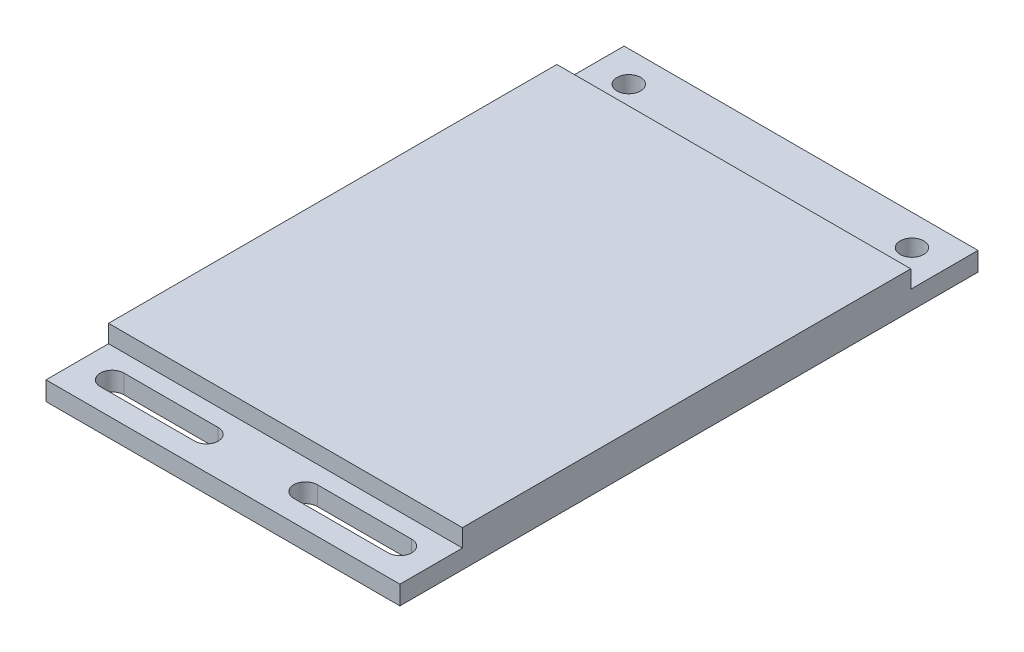
from build123d import *

# Parameters (mm, degrees)
SKETCH_1_W      = 30
SKETCH_1_H      = 49
SKETCH_1_R      = 1
EXTRUDE_1_DEPTH = 1.6
SKETCH_2_W      = 30
SKETCH_2_H      = 38
EXTRUDE_2_DEPTH = 1.5
SKETCH_3_W      = 8.4
SKETCH_3_H      = 5
EXTRUDE_3_DEPTH = 2


with BuildPart() as part:
    # 草图1 → 凸台-拉伸1 (new body)
    with BuildSketch(Plane(origin=(0, 0, 0), x_dir=(1, 0, 0), z_dir=(0, 1, 0))):
        with Locations((15, -24.5)):
            Rectangle(SKETCH_1_W, SKETCH_1_H)
        with BuildLine():
            ThreePointArc((2.8, -47.2), (1.8, -46.2), (2.8, -45.2))
            Line((2.8, -45.2), (10.8, -45.2))
            ThreePointArc((10.8, -45.2), (11.507106781, -45.492893219), (11.8, -46.2))
            ThreePointArc((11.8, -46.2), (11.507106781, -46.907106781), (10.8, -47.2))
            Line((10.8, -47.2), (2.8, -47.2))
        make_face(mode=Mode.SUBTRACT)
        with BuildLine():
            ThreePointArc((19.2, -47.2), (18.2, -46.2), (19.2, -45.2))
            Line((19.2, -45.2), (27.2, -45.2))
            ThreePointArc((27.2, -45.2), (27.907106781, -45.492893219), (28.2, -46.2))
            ThreePointArc((28.2, -46.2), (27.907106781, -46.907106781), (27.2, -47.2))
            Line((27.2, -47.2), (19.2, -47.2))
        make_face(mode=Mode.SUBTRACT)
        with Locations(Location((3, -2.6, 0), (0, 0, 270))):
            Circle(SKETCH_1_R, mode=Mode.SUBTRACT)
        with Locations(Location((27, -2.6, 0), (0, 0, 270))):
            Circle(SKETCH_1_R, mode=Mode.SUBTRACT)
    extrude(amount=EXTRUDE_1_DEPTH)

    # 草图2 → 凸台-拉伸2 (add)
    with BuildSketch(Plane(origin=(0, 1.6, 0), x_dir=(1, 0, 0), z_dir=(0, 1, 0))):
        with Locations((15, -24.7)):
            Rectangle(SKETCH_2_W, SKETCH_2_H)
    extrude(amount=EXTRUDE_2_DEPTH)

    # 草图3 → 凸台-拉伸3 (add)
    with BuildSketch(Plane.XZ):
        with Locations((15, 38)):
            Rectangle(SKETCH_3_W, SKETCH_3_H)
    extrude(amount=EXTRUDE_3_DEPTH)


solid = part.part
